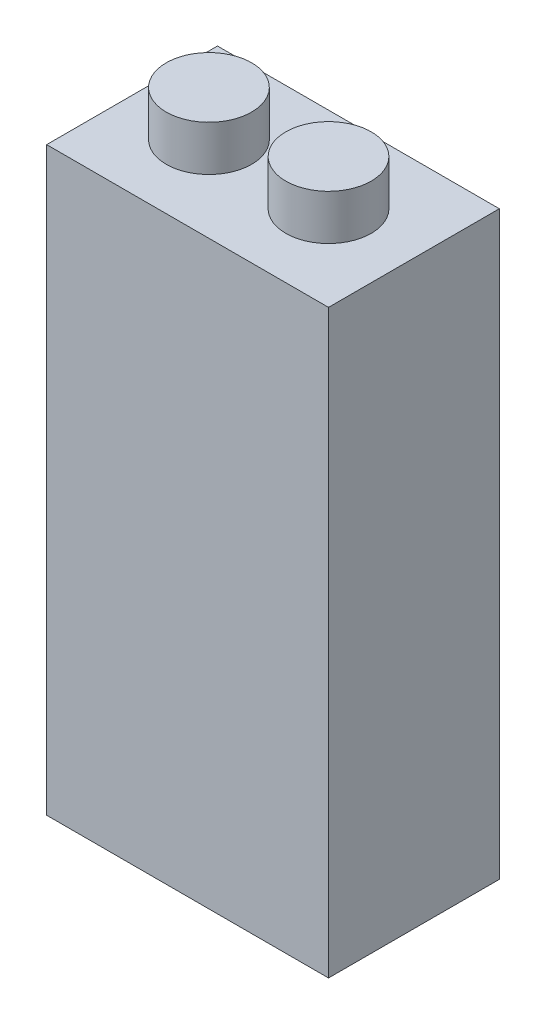
from build123d import *

# Parameters (mm, degrees)
SKETCH1_W           = 33
SKETCH1_H           = 20
BOSS_EXTRUDE2_DEPTH = 68
SKETCH2_R           = 5
BOSS_EXTRUDE3_DEPTH = 5.3


with BuildPart() as part:
    # Sketch1 → Boss-Extrude2 (new body)
    with BuildSketch(Plane(origin=(0, 0, 0), x_dir=(1, 0, 0), z_dir=(0, 1, 0))):
        Rectangle(SKETCH1_W, SKETCH1_H)
    extrude(amount=BOSS_EXTRUDE2_DEPTH)

    # Sketch2 → Boss-Extrude3 (add)
    with BuildSketch(Plane(origin=(0, 68, 0), x_dir=(1, 0, 0), z_dir=(0, 1, 0))):
        with Locations(Location((-7.5, 0, 0), (0, 0, 270))):
            Circle(SKETCH2_R)
        with Locations(Location((6.5, 0, 0), (0, 0, 270))):
            Circle(SKETCH2_R)
    extrude(amount=BOSS_EXTRUDE3_DEPTH)


solid = part.part
